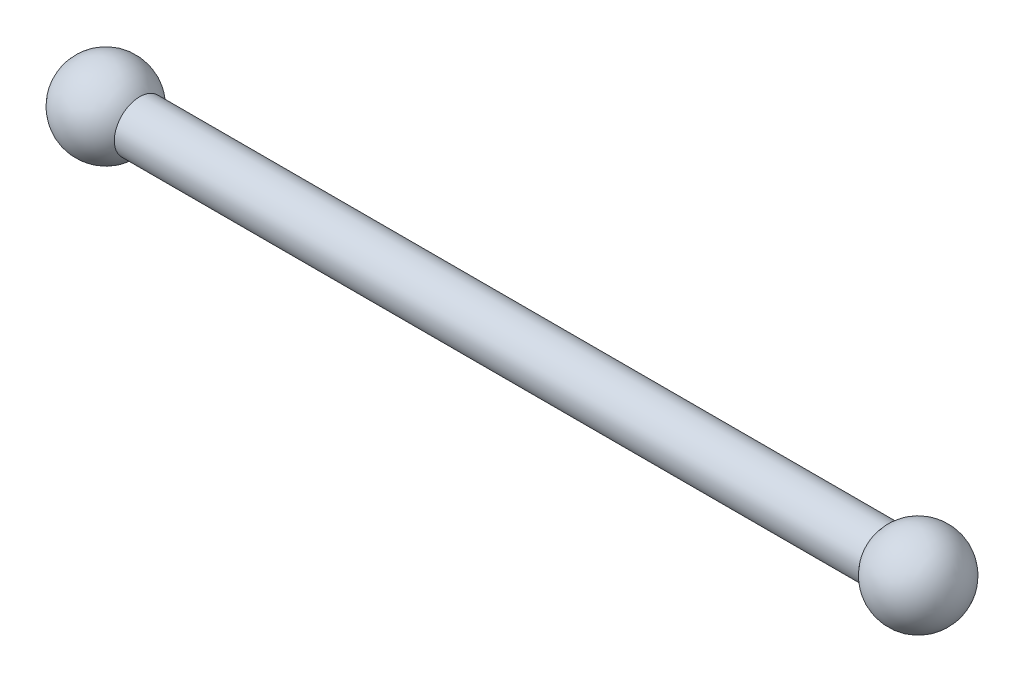
from build123d import *

# Parameters (mm, degrees)
SKETCH5_R   = 1.5
SHAFT_DEPTH = 48


with BuildPart() as part:
    # Sketch4 → Semi-circle Revolve (revolve)
    with BuildSketch(Plane(origin=(0, 0, 0), x_dir=(0, 0, -1), z_dir=(1, 0, 0))):
        with BuildLine():
            Line((0, 0), (2.5, 0))
            Line((2.5, 0), (2.5, -2.5))
            ThreePointArc((2.5, -2.5), (0.732233047, -1.767766953), (0, 0))
        make_face()
    semi_circle_revolve = revolve(axis=Axis((0, 0, -2.5), (0, -1, 0)))

    # Full-circle Mirror: Semi-circle Revolve across plane
    add(semi_circle_revolve.mirror(Plane(origin=(0, 0, 0), x_dir=(0, 0, 1), z_dir=(0, -1, 0))))

    # Sketch5 → Shaft (add)
    with BuildSketch(Plane(origin=(0, 0, 0), x_dir=(0, 0, -1), z_dir=(1, 0, 0))):
        with Locations(Location((2.5, 0, 0), (0, 0, 180))):
            Circle(SKETCH5_R)
    extrude(amount=SHAFT_DEPTH)

    # Sketch6 → Opposite Semi-circle Revolve (revolve)
    with BuildSketch(Plane(origin=(48, 0, 0), x_dir=(0, 0, -1), z_dir=(1, 0, 0))):
        with BuildLine():
            Line((0, 0), (2.5, 0))
            Line((2.5, 0), (2.5, -2.5))
            ThreePointArc((2.5, -2.5), (0.732233047, -1.767766953), (0, 0))
        make_face()
    opposite_semi_circle_revolve = revolve(axis=Axis((48, 0, -2.5), (0, -1, 0)))

    # Opposite Full-circle Mirror: Opposite Semi-circle Revolve across plane
    add(opposite_semi_circle_revolve.mirror(Plane(origin=(48, 0, 0), x_dir=(0, 0, 1), z_dir=(0, 1, 0))))


solid = part.part
